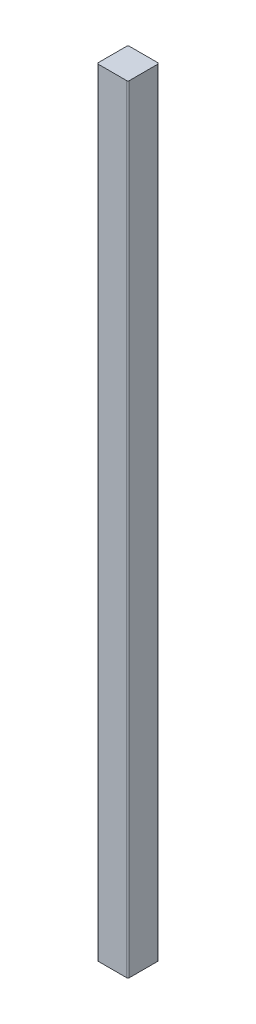
from build123d import *

# Parameters (mm, degrees)
BOSS_EXTRUDE1_DEPTH = 1000


with BuildPart() as part:
    # Sketch1 → Boss-Extrude1 (new body)
    with BuildSketch(Plane(origin=(0, 0, 0), x_dir=(1, 0, 0), z_dir=(0, 1, 0))):
        with BuildLine():
            Line((-18, 20), (18, 20))
            ThreePointArc((18, 20), (19.414213562, 19.414213562), (20, 18))
            Line((20, 18), (20, -18))
            ThreePointArc((20, -18), (19.414213562, -19.414213562), (18, -20))
            Line((18, -20), (-18, -20))
            ThreePointArc((-18, -20), (-19.414213562, -19.414213562), (-20, -18))
            Line((-20, -18), (-20, 18))
            ThreePointArc((-20, 18), (-19.414213562, 19.414213562), (-18, 20))
        make_face()
    extrude(amount=BOSS_EXTRUDE1_DEPTH)


solid = part.part
